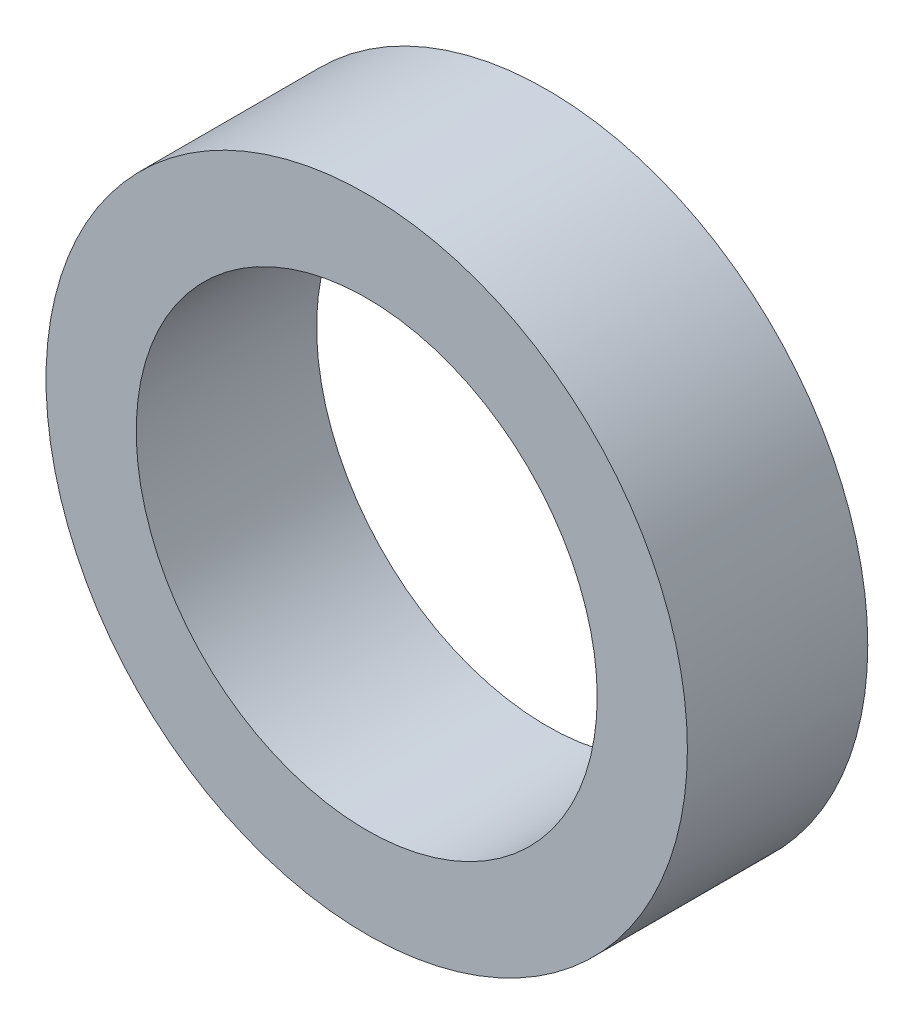
from build123d import *

# Parameters (mm, degrees)
CROQUIS1_R              = 16
CROQUIS1_R_2            = 11.5
SALIENTE_EXTRUIR1_DEPTH = 9


with BuildPart() as part:
    # Croquis1 → Saliente-Extruir1 (new body)
    with BuildSketch(Plane.XY):
        Circle(CROQUIS1_R)
        Circle(CROQUIS1_R_2, mode=Mode.SUBTRACT)
    extrude(amount=SALIENTE_EXTRUIR1_DEPTH)


solid = part.part
